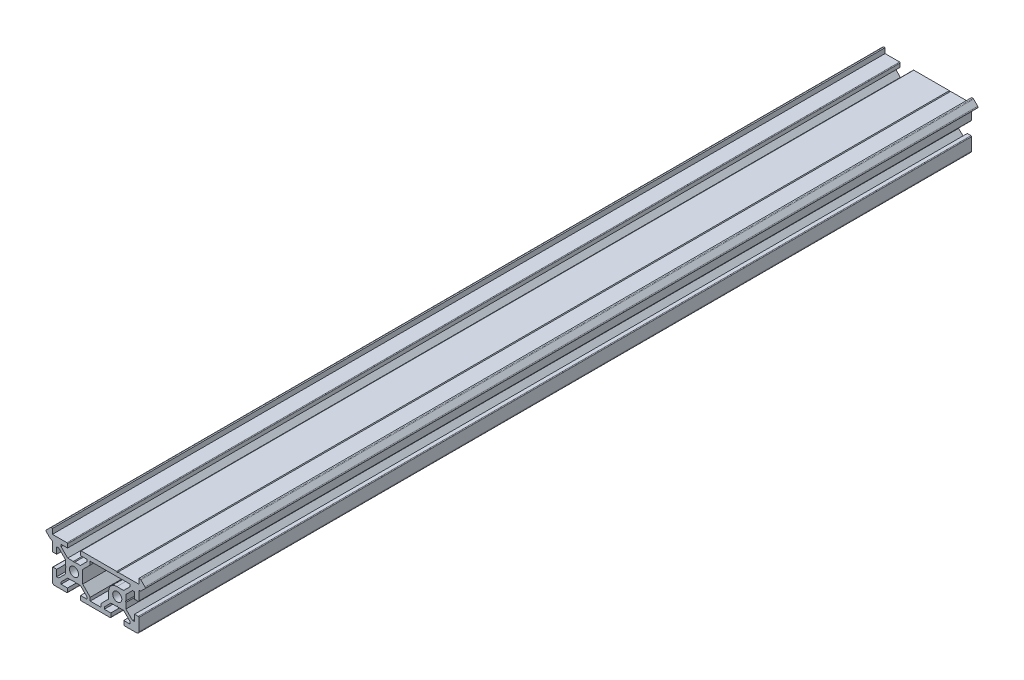
from build123d import *

# Parameters (mm, degrees)
BOSS_EXTRUDE1_START = -385.169813
MODEL_R             = 2.100000001
BOSS_EXTRUDE1_DEPTH = 385.169813


with BuildPart() as part:
    # Model → Boss-Extrude1 (new body)
    with BuildSketch(Plane.XY.offset(BOSS_EXTRUDE1_START)):
        with BuildLine():
            Line((28.771485975, 48.105572105), (30.646485975, 49.980572105))
            ThreePointArc((30.646485975, 49.980572105), (30.808697649, 50.08895848), (31.000039365, 50.127018713))
            Line((31.000039365, 50.127018713), (31.592932584, 50.127018713))
            Line((31.592932584, 50.127018713), (31.592932584, 47.752018713))
            Line((31.592932584, 47.752018713), (38.292932585, 47.752018713))
            ThreePointArc((38.292932585, 47.752018713), (38.505064619, 47.664150748), (38.592932584, 47.452018714))
            Line((38.592932584, 47.452018714), (38.592932584, 45.752018713))
            Line((38.592932584, 45.752018713), (35.592932585, 45.752018713))
            Line((35.592932585, 45.752018713), (35.592932585, 44.812678885))
            Line((35.592932585, 44.812678885), (38.653592756, 41.752018713))
            Line((38.653592756, 41.752018713), (41.292932583, 41.752018713))
            Line((41.292932583, 41.752018713), (41.592932584, 41.452018713))
            Line((41.592932584, 41.452018713), (41.892932586, 41.752018714))
            Line((41.892932586, 41.752018714), (44.532272412, 41.752018714))
            Line((44.532272412, 41.752018714), (47.592932584, 44.812678886))
            Line((47.592932584, 44.812678886), (47.592932584, 45.752018714))
            Line((47.592932584, 45.752018714), (44.592932584, 45.752018714))
            Line((44.592932584, 45.752018714), (44.592932584, 47.452018715))
            ThreePointArc((44.592932584, 47.452018715), (44.68080055, 47.664150749), (44.892932584, 47.752018715))
            Line((44.892932584, 47.752018715), (61.292932583, 47.752018715))
            Line((61.292932583, 47.752018715), (61.592932582, 47.452018715))
            Line((61.592932582, 47.452018715), (61.892932583, 47.752018716))
            Line((61.892932583, 47.752018716), (71.592932583, 47.752018716))
            Line((71.592932583, 47.752018716), (71.592932583, 50.127018711))
            Line((71.592932583, 50.127018711), (72.185825802, 50.127018711))
            ThreePointArc((72.185825802, 50.127018711), (72.377167518, 50.088958477), (72.539379192, 49.980572102))
            Line((72.539379192, 49.980572102), (74.414379192, 48.105572102))
            ThreePointArc((74.414379192, 48.105572102), (74.560825801, 47.752018712), (74.414379192, 47.398465322))
            Line((74.414379192, 47.398465322), (72.539379192, 45.523465322))
            ThreePointArc((72.539379192, 45.523465322), (72.377167518, 45.415078947), (72.185825802, 45.377018714))
            Line((72.185825802, 45.377018714), (72.092932582, 45.377018714))
            ThreePointArc((72.092932582, 45.377018714), (71.739379192, 45.230572103), (71.592932583, 44.877018713))
            Line((71.592932583, 44.877018713), (71.592932583, 41.052018712))
            ThreePointArc((71.592932583, 41.052018712), (71.505064617, 40.839886678), (71.292932581, 40.752018713))
            Line((71.292932581, 40.752018713), (69.592932583, 40.752018713))
            Line((69.592932583, 40.752018713), (69.592932583, 43.752018712))
            Line((69.592932583, 43.752018712), (68.653592755, 43.752018712))
            Line((68.653592755, 43.752018712), (65.592932583, 40.691358541))
            Line((65.592932583, 40.691358541), (65.592932583, 38.052018712))
            Line((65.592932583, 38.052018712), (65.292932584, 37.752018712))
            Line((65.292932584, 37.752018712), (65.592932583, 37.452018713))
            Line((65.592932583, 37.452018713), (65.592932583, 34.812678884))
            Line((65.592932583, 34.812678884), (68.653592755, 31.752018712))
            Line((68.653592755, 31.752018712), (69.592932583, 31.752018712))
            Line((69.592932583, 31.752018712), (69.592932583, 34.752018711))
            Line((69.592932583, 34.752018711), (71.292932581, 34.752018711))
            ThreePointArc((71.292932581, 34.752018711), (71.505064617, 34.664150747), (71.592932583, 34.452018712))
            Line((71.592932583, 34.452018712), (71.592932583, 28.75201871))
            ThreePointArc((71.592932583, 28.75201871), (71.300039364, 28.044911929), (70.592932582, 27.752018711))
            Line((70.592932582, 27.752018711), (64.892932582, 27.752018711))
            ThreePointArc((64.892932582, 27.752018711), (64.680800548, 27.839886676), (64.592932583, 28.05201871))
            Line((64.592932583, 28.05201871), (64.592932583, 29.752018711))
            Line((64.592932583, 29.752018711), (67.592932582, 29.752018711))
            Line((67.592932582, 29.752018711), (67.592932582, 30.69135854))
            Line((67.592932582, 30.69135854), (64.532272411, 33.752018711))
            Line((64.532272411, 33.752018711), (61.892932584, 33.752018711))
            Line((61.892932584, 33.752018711), (61.592932582, 34.052018713))
            Line((61.592932582, 34.052018713), (61.292932582, 33.752018712))
            Line((61.292932582, 33.752018712), (58.653592755, 33.752018712))
            Line((58.653592755, 33.752018712), (55.592932583, 30.691358541))
            Line((55.592932583, 30.691358541), (55.592932583, 29.752018713))
            Line((55.592932583, 29.752018713), (58.592932583, 29.752018713))
            Line((58.592932583, 29.752018713), (58.592932583, 28.052018712))
            ThreePointArc((58.592932583, 28.052018712), (58.505064617, 27.839886678), (58.292932583, 27.752018712))
            Line((58.292932583, 27.752018712), (44.892932584, 27.752018712))
            ThreePointArc((44.892932584, 27.752018712), (44.68080055, 27.839886678), (44.592932584, 28.052018712))
            Line((44.592932584, 28.052018712), (44.592932584, 29.752018713))
            Line((44.592932584, 29.752018713), (47.592932584, 29.752018713))
            Line((47.592932584, 29.752018713), (47.592932584, 30.691358541))
            Line((47.592932584, 30.691358541), (44.532272412, 33.752018712))
            Line((44.532272412, 33.752018712), (41.892932586, 33.752018712))
            Line((41.892932586, 33.752018712), (41.592932584, 34.052018714))
            Line((41.592932584, 34.052018714), (41.292932583, 33.752018714))
            Line((41.292932583, 33.752018714), (38.653592756, 33.752018714))
            Line((38.653592756, 33.752018714), (35.592932585, 30.691358542))
            Line((35.592932585, 30.691358542), (35.592932585, 29.752018714))
            Line((35.592932585, 29.752018714), (38.592932584, 29.752018714))
            Line((38.592932584, 29.752018714), (38.592932584, 28.052018713))
            ThreePointArc((38.592932584, 28.052018713), (38.505064619, 27.839886679), (38.292932585, 27.752018714))
            Line((38.292932585, 27.752018714), (32.592932585, 27.752018714))
            ThreePointArc((32.592932585, 27.752018714), (31.885825803, 28.044911931), (31.592932584, 28.752018713))
            Line((31.592932584, 28.752018713), (31.592932584, 34.452018715))
            ThreePointArc((31.592932584, 34.452018715), (31.68080055, 34.664150748), (31.892932583, 34.752018714))
            Line((31.892932583, 34.752018714), (33.592932584, 34.752018714))
            Line((33.592932584, 34.752018714), (33.592932584, 31.752018715))
            Line((33.592932584, 31.752018715), (34.532272412, 31.752018715))
            Line((34.532272412, 31.752018715), (37.592932584, 34.812678886))
            Line((37.592932584, 34.812678886), (37.592932584, 37.452018715))
            Line((37.592932584, 37.452018715), (37.892932583, 37.752018715))
            Line((37.892932583, 37.752018715), (37.592932584, 38.052018714))
            Line((37.592932584, 38.052018714), (37.592932584, 40.691358543))
            Line((37.592932584, 40.691358543), (34.532272412, 43.752018715))
            Line((34.532272412, 43.752018715), (33.592932584, 43.752018715))
            Line((33.592932584, 43.752018715), (33.592932584, 40.752018716))
            Line((33.592932584, 40.752018716), (31.892932586, 40.752018716))
            ThreePointArc((31.892932586, 40.752018716), (31.68080055, 40.83988668), (31.592932584, 41.052018715))
            Line((31.592932584, 41.052018715), (31.592932584, 44.877018715))
            ThreePointArc((31.592932584, 44.877018715), (31.446485975, 45.230572106), (31.092932585, 45.377018716))
            Line((31.092932585, 45.377018716), (31.000039365, 45.377018716))
            ThreePointArc((31.000039365, 45.377018716), (30.808697649, 45.41507895), (30.646485975, 45.523465324))
            Line((30.646485975, 45.523465324), (28.771485975, 47.398465325))
            ThreePointArc((28.771485975, 47.398465325), (28.625039366, 47.752018715), (28.771485975, 48.105572105))
        make_face()
        with Locations((61.592932582, 37.752018715)):
            Circle(MODEL_R, mode=Mode.SUBTRACT)
        with Locations((41.592932582, 37.752018715)):
            Circle(MODEL_R, mode=Mode.SUBTRACT)
        with BuildLine():
            Line((54.092932584, 29.752018715), (49.092932584, 29.752018715))
            Line((49.092932584, 29.752018715), (49.092932584, 31.312678886))
            Line((49.092932584, 31.312678886), (45.592932583, 34.812678886))
            Line((45.592932583, 34.812678886), (45.592932583, 40.691358543))
            Line((45.592932583, 40.691358543), (49.092932584, 44.191358544))
            Line((49.092932584, 44.191358544), (49.092932584, 45.752018714))
            Line((49.092932584, 45.752018714), (67.592932582, 45.752018714))
            Line((67.592932582, 45.752018714), (67.592932582, 44.812678887))
            Line((67.592932582, 44.812678887), (64.532272411, 41.752018716))
            Line((64.532272411, 41.752018716), (61.402932584, 41.752018716))
            ThreePointArc((61.402932584, 41.752018716), (58.708855747, 40.636095552), (57.592932584, 37.942018716))
            Line((57.592932584, 37.942018716), (57.592932584, 34.812678886))
            Line((57.592932584, 34.812678886), (54.092932584, 31.312678886))
            Line((54.092932584, 31.312678886), (54.092932584, 29.752018715))
        make_face(mode=Mode.SUBTRACT)
    extrude(amount=BOSS_EXTRUDE1_DEPTH)


solid = part.part
